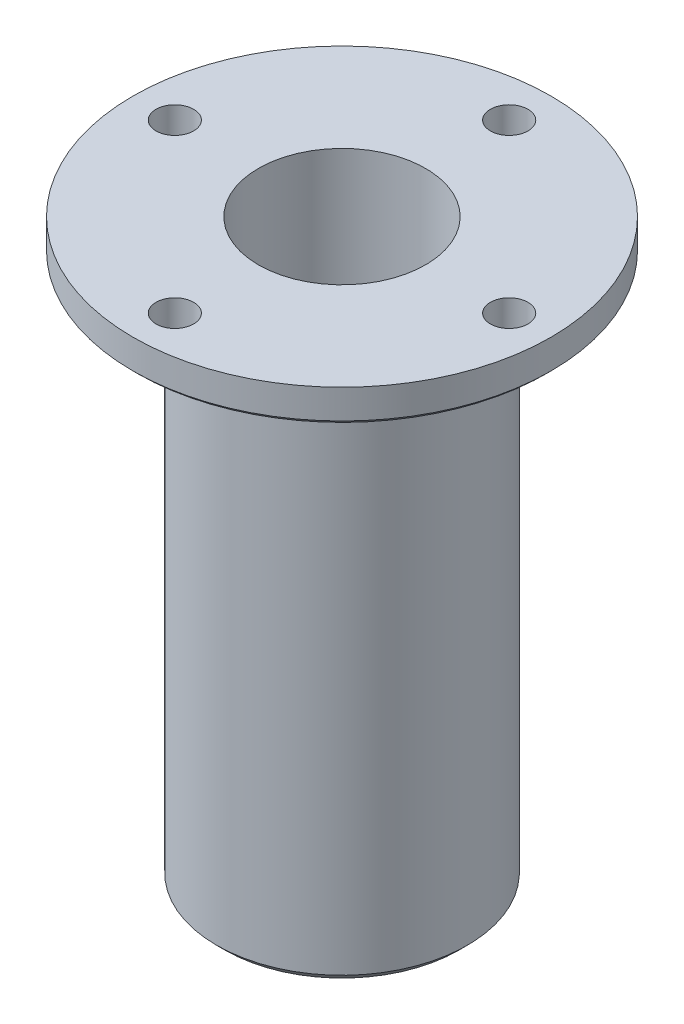
from build123d import *

# Parameters (mm, degrees)
SKETCH1_R           = 15
SKETCH1_R_2         = 10
BOSS_EXTRUDE1_DEPTH = 65
SKETCH2_R           = 25
SKETCH2_R_2         = 10
SKETCH2_R_3         = 2.25
BOSS_EXTRUDE2_DEPTH = 4
SKETCH4_R           = 1.4
CUT_EXTRUDE1_DEPTH  = 20
CHAMFER1_SIZE       = 1
CHAMFER2_SIZE       = 0.5
FILLET1_R           = 0.5


with BuildPart() as part:
    # Sketch1 → Boss-Extrude1 (new body)
    with BuildSketch(Plane(origin=(0, 0, 0), x_dir=(1, 0, 0), z_dir=(0, 1, 0))):
        with Locations(Location((0, 0, 0), (0, 0, 270))):
            Circle(SKETCH1_R)
        with Locations(Location((0, 0, 0), (0, 0, 270))):
            Circle(SKETCH1_R_2, mode=Mode.SUBTRACT)
    extrude(amount=BOSS_EXTRUDE1_DEPTH)

    # Sketch2 → Boss-Extrude2 (add)
    with BuildSketch(Plane(origin=(0, 65, 0), x_dir=(1, 0, 0), z_dir=(0, 1, 0))):
        with Locations(Location((0, 0, 0), (0, 0, 270))):
            Circle(SKETCH2_R)
        with Locations(Location((0, 0, 0), (0, 0, 270))):
            Circle(SKETCH2_R_2, mode=Mode.SUBTRACT)
        with Locations(Location((20, 0, 0), (0, 0, 270))):
            Circle(SKETCH2_R_3, mode=Mode.SUBTRACT)
        with Locations(Location((0, -20, 0), (0, 0, 270))):
            Circle(SKETCH2_R_3, mode=Mode.SUBTRACT)
        with Locations(Location((-20, 0, 0), (0, 0, 270))):
            Circle(SKETCH2_R_3, mode=Mode.SUBTRACT)
        with Locations(Location((0, 20, 0), (0, 0, 270))):
            Circle(SKETCH2_R_3, mode=Mode.SUBTRACT)
    extrude(amount=BOSS_EXTRUDE2_DEPTH)

    # Sketch4 → Cut-Extrude1 (cut)
    with BuildSketch(Plane.XZ):
        with Locations(Location((12.5, 0, 0), (0, 0, 270))):
            Circle(SKETCH4_R)
        with Locations(Location((0, -12.5, 0), (0, 0, 270))):
            Circle(SKETCH4_R)
        with Locations(Location((-12.5, 0, 0), (0, 0, 270))):
            Circle(SKETCH4_R)
        with Locations(Location((0, 12.5, 0), (0, 0, 270))):
            Circle(SKETCH4_R)
    extrude(amount=-CUT_EXTRUDE1_DEPTH, mode=Mode.SUBTRACT)

    # Chamfer1
    chamfer1_edges = [part.edges().sort_by_distance(p)[0] for p in [
        (0, 0, -15),
    ]]
    chamfer(chamfer1_edges, length=CHAMFER1_SIZE)

    # Chamfer2
    chamfer2_edges = [part.edges().sort_by_distance(p)[0] for p in [
        (0, 65, -25),
    ]]
    chamfer(chamfer2_edges, length=CHAMFER2_SIZE)

    # Fillet1
    fillet1_edges = [part.edges().sort_by_distance(p)[0] for p in [
        (0, 65, -15),
    ]]
    fillet(fillet1_edges, radius=FILLET1_R)


solid = part.part
